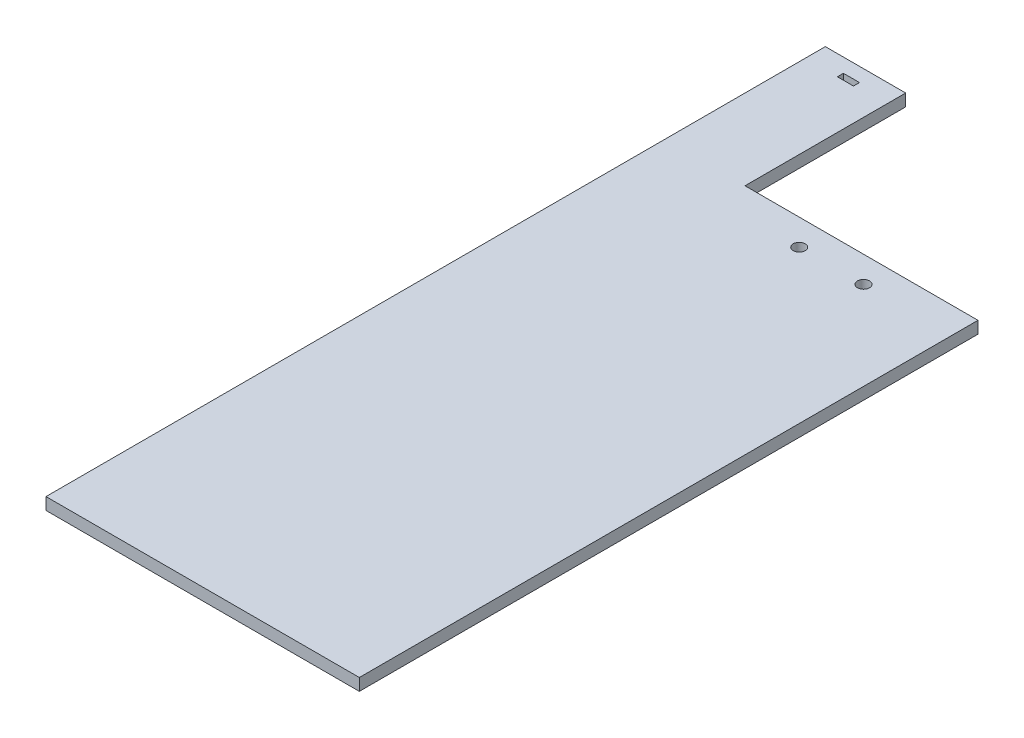
from build123d import *

# Parameters (mm, degrees)
SKETCH1_W           = 4
SKETCH1_H           = 1.5
BOSS_EXTRUDE1_DEPTH = 3
SKETCH6_W           = 12
SKETCH6_H           = 3
CUT_EXTRUDE5_DEPTH  = 214.880807928
SKETCH10_R          = 1.5
CUT_EXTRUDE9_DEPTH  = 10


with BuildPart() as part:
    # Sketch1 → Boss-Extrude1 (new body)
    with BuildSketch(Plane(origin=(0, 0, 0), x_dir=(1, 0, 0), z_dir=(0, 1, 0))):
        Polygon((0, 154), (0, 194), (20, 194), (20, 154), (90, 154), (90, 0), (0, 0), align=None)
        with Locations((10, 189.75)):
            Rectangle(SKETCH1_W, SKETCH1_H, mode=Mode.SUBTRACT)
    extrude(amount=BOSS_EXTRUDE1_DEPTH)

    # Sketch6 → Cut-Extrude5 (cut, through all)
    with BuildSketch(Plane.XY):
        with Locations((84, 1.5)):
            Rectangle(SKETCH6_W, SKETCH6_H)
    extrude(amount=-CUT_EXTRUDE5_DEPTH, mode=Mode.SUBTRACT)

    # Sketch10 → Cut-Extrude9 (cut)
    with BuildSketch(Plane(origin=(0, 3, 0), x_dir=(1, 0, 0), z_dir=(0, 1, 0))):
        with Locations(Location((40, 147.5, 0), (0, 0, 270))):
            Circle(SKETCH10_R)
        with Locations(Location((56, 147.5, 0), (0, 0, 270))):
            Circle(SKETCH10_R)
    extrude(amount=-CUT_EXTRUDE9_DEPTH, mode=Mode.SUBTRACT)


solid = part.part
